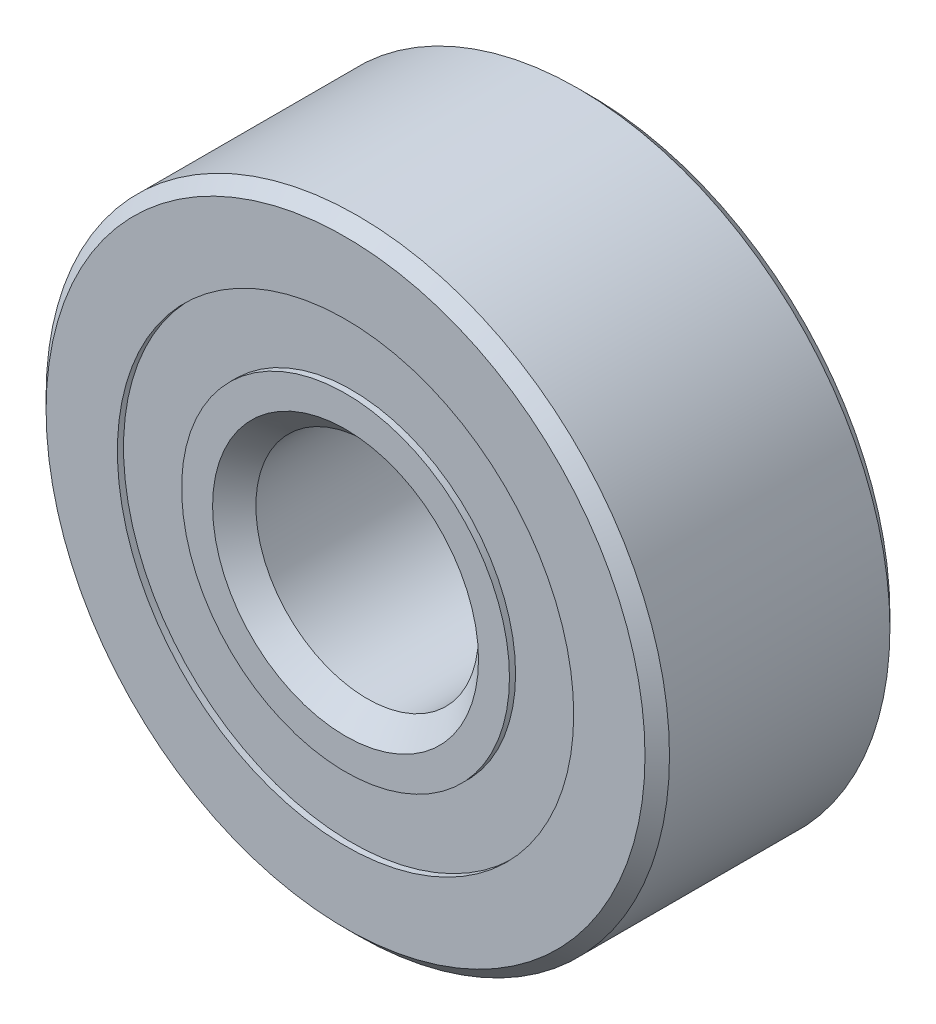
from build123d import *

# Parameters (mm, degrees)
CIRPATTERN1_COUNT = 8
SKETCH5_W         = 2.118431907
SKETCH5_H         = 2.289894513


with BuildPart() as part:
    # Sketch1 → Revolve1 (revolve)
    with BuildSketch(Plane(origin=(0, 0, 0), x_dir=(0, 0, -1), z_dir=(1, 0, 0))):
        with BuildLine():
            Line((3.9290625, 11.1125), (-3.9290625, 11.1125))
            Line((-3.9290625, 11.1125), (-4.365625, 10.6759375))
            Line((-4.365625, 10.6759375), (-4.365625, 8.133756868))
            Line((-4.365625, 8.133756868), (-1.940277778, 8.133756868))
            ThreePointArc((-1.940277778, 8.133756868), (0, 9.569536843), (1.940277778, 8.133756868))
            Line((1.940277778, 8.133756868), (4.365625, 8.133756868))
            Line((4.365625, 8.133756868), (4.365625, 10.6759375))
            Line((4.365625, 10.6759375), (3.9290625, 11.1125))
        make_face()
    revolve(axis=Axis((0, 0, 4.365625), (0, 0, -1)))


with BuildPart() as body_2:
    # Sketch3 → Revolve3 (revolve)
    with BuildSketch(Plane(origin=(0, 0, 0), x_dir=(0, 0, -1), z_dir=(1, 0, 0))):
        with BuildLine():
            Line((-4.14734375, 5.625581105), (-3.261994223, 4.740231578))
            Line((-3.261994223, 4.740231578), (0, 4.740231578))
            Line((0, 4.740231578), (0, 5.511713157))
            ThreePointArc((0, 5.511713157), (1.206870125, 5.909690369), (1.940277778, 6.947493132))
            Line((1.940277778, 6.947493132), (4.365625, 6.947493132))
            Line((4.365625, 6.947493132), (4.365625, 4.4053125))
            Line((4.365625, 4.4053125), (3.9290625, 3.96875))
            Line((3.9290625, 3.96875), (-3.594143422, 3.96875))
            Line((-3.594143422, 3.96875), (-4.365625, 4.740231578))
            Line((-4.365625, 4.740231578), (-4.365625, 5.843862355))
            Line((-4.365625, 5.843862355), (-4.14734375, 5.843862355))
            Line((-4.14734375, 5.843862355), (-4.14734375, 5.625581105))
        make_face()
    revolve(axis=Axis((0, 0, 4.365625), (0, 0, -1)))


with BuildPart() as body_3:
    # Sketch4 → Revolve4 (revolve)
    with BuildSketch(Plane(origin=(0, 0, 0), x_dir=(0, 0, -1), z_dir=(1, 0, 0))):
        with BuildLine():
            Line((-2.028911843, 7.540625), (2.028911843, 7.540625))
            ThreePointArc((2.028911843, 7.540625), (0, 9.569536843), (-2.028911843, 7.540625))
        make_face()
    revolve(axis=Axis((0, 7.540625, 2.028911843), (0, 0, -1)))


with BuildPart() as cirpattern1_1:
    # CirPattern1: pattern copy
    add(body_3.part.rotate(Axis((0, 0, -4.365625), (0, 0, 1)), 1 * 360 / CIRPATTERN1_COUNT))


with BuildPart() as cirpattern1_2:
    # CirPattern1: pattern copy
    add(body_3.part.rotate(Axis((0, 0, -4.365625), (0, 0, 1)), 2 * 360 / CIRPATTERN1_COUNT))


with BuildPart() as cirpattern1_3:
    # CirPattern1: pattern copy
    add(body_3.part.rotate(Axis((0, 0, -4.365625), (0, 0, 1)), 3 * 360 / CIRPATTERN1_COUNT))


with BuildPart() as cirpattern1_4:
    # CirPattern1: pattern copy
    add(body_3.part.rotate(Axis((0, 0, -4.365625), (0, 0, 1)), 4 * 360 / CIRPATTERN1_COUNT))


with BuildPart() as cirpattern1_5:
    # CirPattern1: pattern copy
    add(body_3.part.rotate(Axis((0, 0, -4.365625), (0, 0, 1)), 5 * 360 / CIRPATTERN1_COUNT))


with BuildPart() as cirpattern1_6:
    # CirPattern1: pattern copy
    add(body_3.part.rotate(Axis((0, 0, -4.365625), (0, 0, 1)), 6 * 360 / CIRPATTERN1_COUNT))


with BuildPart() as cirpattern1_7:
    # CirPattern1: pattern copy
    add(body_3.part.rotate(Axis((0, 0, -4.365625), (0, 0, 1)), 7 * 360 / CIRPATTERN1_COUNT))


with BuildPart() as body_11:
    # Sketch5 → Revolve5 (revolve)
    with BuildSketch(Plane(origin=(0, 0, 0), x_dir=(0, 0, -1), z_dir=(1, 0, 0))):
        with Locations((-3.088127797, 6.988809612)):
            Rectangle(SKETCH5_W, SKETCH5_H)
        with Locations((3.088127797, 6.988809612)):
            Rectangle(SKETCH5_W, SKETCH5_H)
    revolve(axis=Axis((0, 0, 4.365625), (0, 0, -1)))


solid = Compound([part.part, body_2.part, body_3.part, cirpattern1_1.part, cirpattern1_2.part, cirpattern1_3.part, cirpattern1_4.part, cirpattern1_5.part, cirpattern1_6.part, cirpattern1_7.part, body_11.part])
